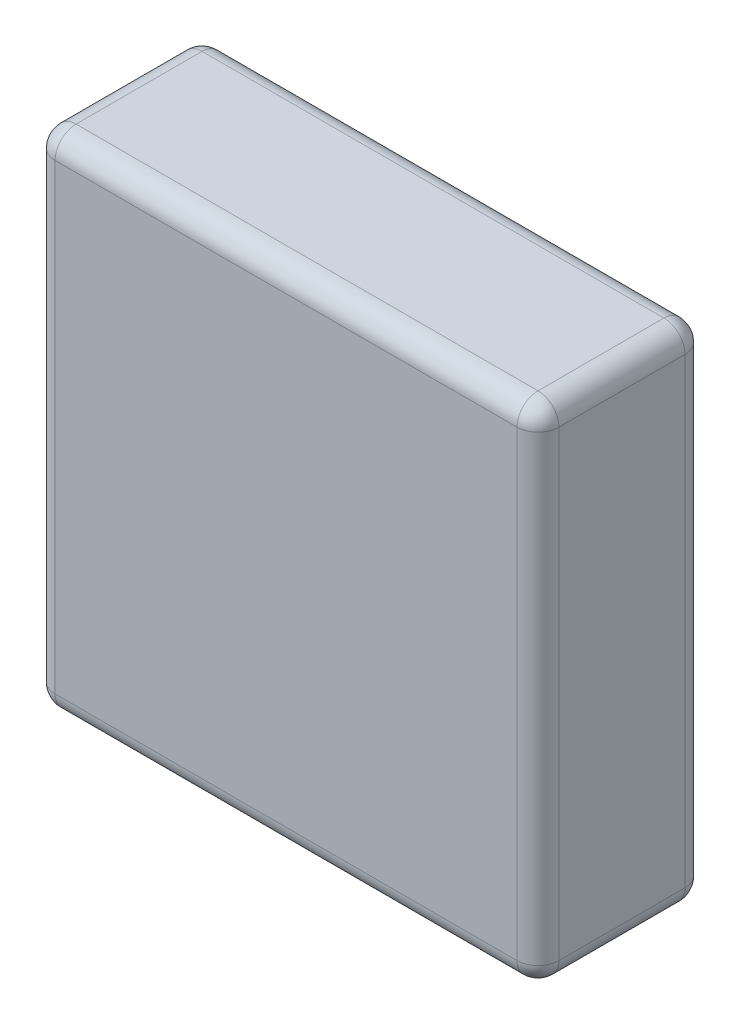
from build123d import *

# Parameters (mm, degrees)
SKETCH_1_W      = 120
SKETCH_1_H      = 120
EXTRUDE_1_DEPTH = 40
FILLET_1_R      = 5


with BuildPart() as part:
    # 草图1 → 凸台-拉伸1 (new body)
    with BuildSketch(Plane.XY):
        with Locations((60, -60)):
            Rectangle(SKETCH_1_W, SKETCH_1_H)
    extrude(amount=EXTRUDE_1_DEPTH)

    # 圆角1
    fillet_1_edges = [part.edges().sort_by_distance(p)[0] for p in [
        (120, -60, 40),
        (60, 0, 40),
        (0, -60, 40),
        (60, 0, 0),
        (120, -60, 0),
        (60, -120, 0),
        (0, -60, 0),
        (0, 0, 20),
        (120, 0, 20),
        (120, -120, 20),
        (0, -120, 20),
        (60, -120, 40),
    ]]
    fillet(fillet_1_edges, radius=FILLET_1_R)


solid = part.part
